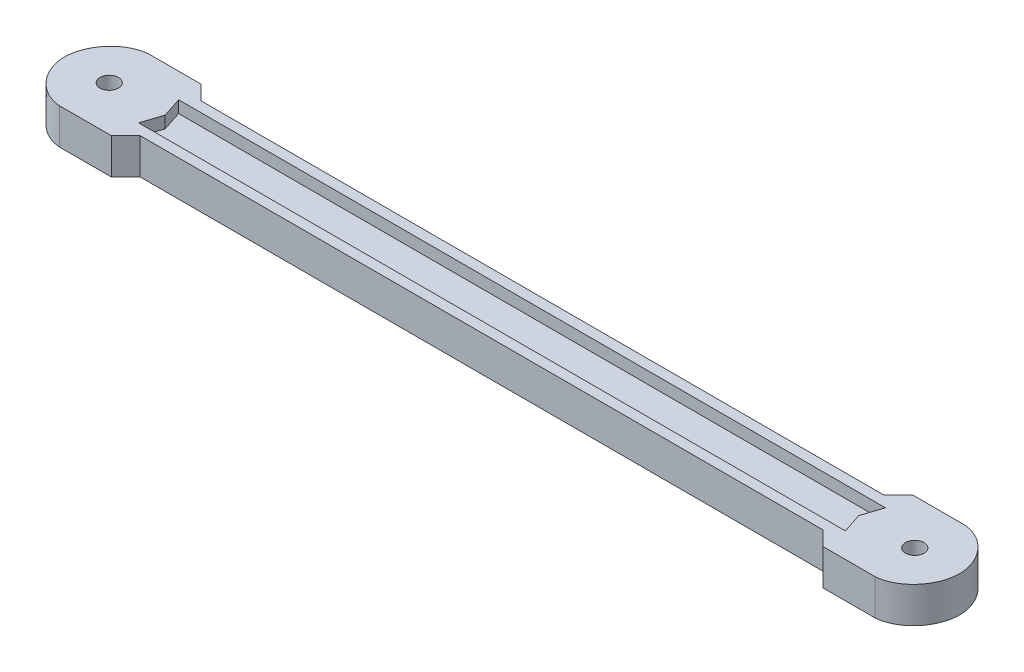
from build123d import *

# Parameters (mm, degrees)
ESQUISSE1_W             = 150
ESQUISSE1_H             = 15
BOSS_EXTRU_1_DEPTH      = 6
ESQUISSE4_W             = 165.64112288
ESQUISSE4_H             = 30
ENL_V_MAT_EXTRU_1_DEPTH = 12
ESQUISSE3_R             = 1.55
ENL_V_MAT_EXTRU_2_DEPTH = 12
ENL_V_MAT_EXTRU_3_DEPTH = 2


with BuildPart() as part:
    # Esquisse1 → Boss.-Extru.1 (new body)
    with BuildSketch(Plane(origin=(0, 0, 0), x_dir=(1, 0, 0), z_dir=(0, 1, 0))):
        Rectangle(ESQUISSE1_W, ESQUISSE1_H)
    extrude(amount=BOSS_EXTRU_1_DEPTH)

    # Esquisse4 → Enlèv. mat.-Extru.1 (cut)
    with BuildSketch(Plane(origin=(0, 6, 0), x_dir=(1, 0, 0), z_dir=(0, 1, 0))):
        Rectangle(ESQUISSE4_W, ESQUISSE4_H)
        with BuildLine():
            Line((-59.659158072, 7.5), (-57.238516234, 5.079358161))
            Line((-57.238516234, 5.079358161), (57.238516234, 5.079358161))
            Line((57.238516234, 5.079358161), (59.659158072, 7.5))
            Line((59.659158072, 7.5), (67.5, 7.5))
            add(Edge.make_bspline(
                [(67.5, 7.5), (71.58518124, 7.773957054), (78.414818759, -1e-09), (71.585181242, -7.773957053), (67.5, -7.5)],
                knots=[0, 0, 0, 0, 0.5, 1, 1, 1, 1], degree=3))
            Line((67.5, -7.5), (59.659158072, -7.5))
            Line((59.659158072, -7.5), (57.238516234, -5.079358161))
            Line((57.238516234, -5.079358161), (-57.238516234, -5.079358161))
            Line((-57.238516234, -5.079358161), (-59.659158072, -7.5))
            Line((-59.659158072, -7.5), (-67.5, -7.5))
            add(Edge.make_bspline(
                [(-67.5, 7.5), (-71.58518124, 7.773957054), (-78.414818759, -1e-09), (-71.585181242, -7.773957053), (-67.5, -7.5)],
                knots=[0, 0, 0, 0, 0.5, 1, 1, 1, 1], degree=3))
            Line((-67.5, 7.5), (-59.659158072, 7.5))
        make_face(mode=Mode.SUBTRACT)
    extrude(amount=-ENL_V_MAT_EXTRU_1_DEPTH, mode=Mode.SUBTRACT)

    # Esquisse3 → Enlèv. mat.-Extru.2 (cut)
    with BuildSketch(Plane.XZ):
        with Locations(Location((-67.5, 0, 0), (0, 0, 270))):
            Circle(ESQUISSE3_R)
        with Locations(Location((67.5, 0, 0), (0, 0, 270))):
            Circle(ESQUISSE3_R)
    extrude(amount=-ENL_V_MAT_EXTRU_2_DEPTH, mode=Mode.SUBTRACT)

    # Esquisse5 → Enlèv. mat.-Extru.3 (cut)
    with BuildSketch(Plane(origin=(0, 6, 0), x_dir=(1, 0, 0), z_dir=(0, 1, 0))):
        Polygon((-58.124952607, 0), (-59.217415088, 3.351936497), (59.217415088, 3.351936497), (58.124952607, 0), (59.217415088, -3.351936497), (-59.217415088, -3.351936497), align=None)
    extrude(amount=-ENL_V_MAT_EXTRU_3_DEPTH, mode=Mode.SUBTRACT)


solid = part.part
